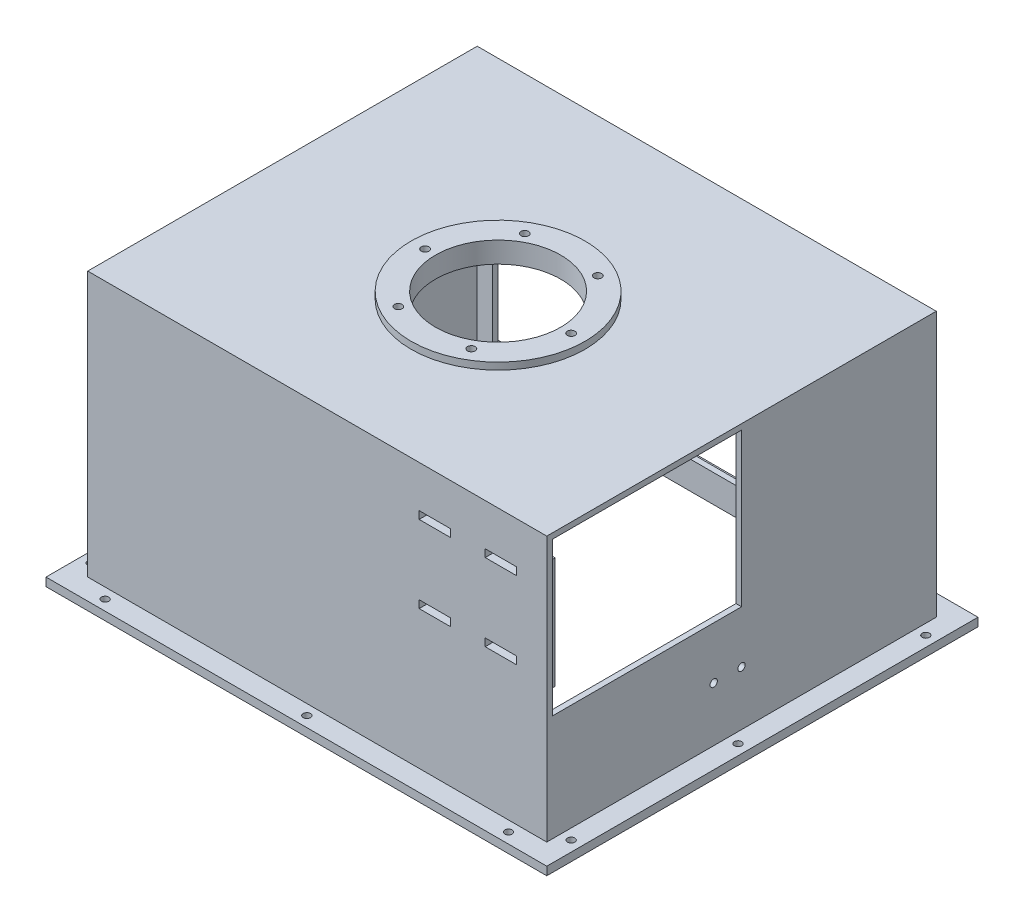
from build123d import *

# Parameters (mm, degrees)
SCHIZZO1_W                        = 720
SCHIZZO1_H                        = 620
ESTRUSIONE_ESTRUSIONE1_DEPTH      = 393
SCHIZZO3_W                        = 720
SCHIZZO3_H                        = 620
SCHIZZO3_W_2                      = 660
SCHIZZO3_H_2                      = 560
TAGLIO_ESTRUSIONE1_DEPTH          = 381
SCHIZZO4_R                        = 5.25
TAGLIO_ESTRUSIONE2_DEPTH          = 12
SCHIZZO5_W                        = 644
SCHIZZO5_H                        = 544
TAGLIO_ESTRUSIONE3_DEPTH          = 385
ESTRUSIONE_ESTRUSIONE2_DEPTH      = 10
ESTRUSIONE_ESTRUSIONE2_DEPTH_BACK = 20
SCHIZZO6_R                        = 125
SCHIZZO7_R                        = 90
TAGLIO_ESTRUSIONE4_DEPTH          = 30
FORO_PER_VITE_M10_1_D             = 11
RIPETIZIONECIRCOLARE1_COUNT       = 6
SCHIZZO14_W                       = 600
SCHIZZO14_H                       = 300
TAGLIO_ESTRUSIONE5_DEPTH          = 8
SCHIZZO16_R                       = 5.25
TAGLIO_ESTRUSIONE6_DEPTH          = 8
TAGLIO_ESTRUSIONE7_START          = -8
SCHIZZO17_R                       = 5.25
TAGLIO_ESTRUSIONE7_DEPTH          = 8
SCHIZZO18_W                       = 272
SCHIZZO18_H                       = 220
TAGLIO_ESTRUSIONE8_DEPTH          = 8
SCHIZZO19_W                       = 200
SCHIZZO19_H                       = 160
ESTRUSIONE_ESTRUSIONE3_DEPTH      = 12
SCHIZZO20_W                       = 45
SCHIZZO20_H                       = 11
TAGLIO_ESTRUSIONE9_DEPTH          = 20


with BuildPart() as part:
    # Schizzo1 → Estrusione-Estrusione1 (new body)
    with BuildSketch(Plane(origin=(0, 0, 0), x_dir=(1, 0, 0), z_dir=(0, 1, 0))):
        with Locations((360, 310)):
            Rectangle(SCHIZZO1_W, SCHIZZO1_H)
    extrude(amount=ESTRUSIONE_ESTRUSIONE1_DEPTH)

    # Schizzo3 → Taglio-Estrusione1 (cut)
    with BuildSketch(Plane(origin=(0, 393, 0), x_dir=(1, 0, 0), z_dir=(0, 1, 0))):
        with Locations((360, 310)):
            Rectangle(SCHIZZO3_W, SCHIZZO3_H)
        with Locations((360, 310)):
            Rectangle(SCHIZZO3_W_2, SCHIZZO3_H_2, mode=Mode.SUBTRACT)
    extrude(amount=-TAGLIO_ESTRUSIONE1_DEPTH, mode=Mode.SUBTRACT)

    # Schizzo4 → Taglio-Estrusione2 (cut)
    with BuildSketch(Plane(origin=(0, 12, 0), x_dir=(1, 0, 0), z_dir=(0, 1, 0))):
        with Locations(Location((360, 605, 0), (0, 0, 270))):
            Circle(SCHIZZO4_R)
        with Locations(Location((650, 605, 0), (0, 0, 270))):
            Circle(SCHIZZO4_R)
        with Locations(Location((70, 605, 0), (0, 0, 90))):
            Circle(SCHIZZO4_R)
        with Locations(Location((650, 15, 0), (0, 0, 90))):
            Circle(SCHIZZO4_R)
        with Locations(Location((360, 15, 0), (0, 0, 90))):
            Circle(SCHIZZO4_R)
        with Locations(Location((70, 15, 0), (0, 0, 270))):
            Circle(SCHIZZO4_R)
        with Locations(Location((705, 560, 0), (0, 0, 270))):
            Circle(SCHIZZO4_R)
        with Locations(Location((705, 290, 0), (0, 0, 270))):
            Circle(SCHIZZO4_R)
        with Locations(Location((705, 50, 0), (0, 0, 270))):
            Circle(SCHIZZO4_R)
        with Locations(Location((15, 50, 0), (0, 0, 90))):
            Circle(SCHIZZO4_R)
        with Locations(Location((15, 290, 0), (0, 0, 90))):
            Circle(SCHIZZO4_R)
        with Locations(Location((15, 560, 0), (0, 0, 90))):
            Circle(SCHIZZO4_R)
    extrude(amount=-TAGLIO_ESTRUSIONE2_DEPTH, mode=Mode.SUBTRACT)

    # Schizzo5 → Taglio-Estrusione3 (cut)
    with BuildSketch(Plane(origin=(0, 0, 0), x_dir=(1, 0, 0), z_dir=(0, 1, 0))):
        with Locations((360, 310)):
            Rectangle(SCHIZZO5_W, SCHIZZO5_H)
    extrude(amount=TAGLIO_ESTRUSIONE3_DEPTH, mode=Mode.SUBTRACT)

    # Schizzo6 → Estrusione-Estrusione2 (add, two sides: drawn at the far end of the back side and taken through both)
    with BuildSketch(Plane(origin=(0, 393, 0), x_dir=(1, 0, 0), z_dir=(0, 1, 0)).offset(-ESTRUSIONE_ESTRUSIONE2_DEPTH_BACK)):
        with Locations(Location((360, 290, 0), (0, 0, 270))):
            Circle(SCHIZZO6_R)
    extrude(amount=ESTRUSIONE_ESTRUSIONE2_DEPTH + ESTRUSIONE_ESTRUSIONE2_DEPTH_BACK)

    # Schizzo7 → Taglio-Estrusione4 (cut)
    with BuildSketch(Plane(origin=(0, 403, 0), x_dir=(1, 0, 0), z_dir=(0, 1, 0))):
        with Locations(Location((360, 290, 0), (0, 0, 270))):
            Circle(SCHIZZO7_R)
    extrude(amount=-TAGLIO_ESTRUSIONE4_DEPTH, mode=Mode.SUBTRACT)

    # Foro per Vite M10-1 (through all)
    with Locations(Plane(origin=(465, 403, -290), x_dir=(0, 0, 1), z_dir=(0, 1, 0))):
        with Locations((0, 0)):
            foro_per_vite_m10_1 = Hole(FORO_PER_VITE_M10_1_D / 2)

    # RipetizioneCircolare1: Foro per Vite M10-1 ×6 about axis
    ripetizionecircolare1_axis = Axis((360, 0, -290), (0, 1, 0))
    for i in range(1, RIPETIZIONECIRCOLARE1_COUNT):
        add(foro_per_vite_m10_1.rotate(ripetizionecircolare1_axis, i * 360 / RIPETIZIONECIRCOLARE1_COUNT), mode=Mode.SUBTRACT)

    # Schizzo14 → Taglio-Estrusione5 (cut)
    with BuildSketch(Plane.XY.offset(-582)):
        with Locations((360, 190)):
            Rectangle(SCHIZZO14_W, SCHIZZO14_H)
    extrude(amount=-TAGLIO_ESTRUSIONE5_DEPTH, mode=Mode.SUBTRACT)

    # Schizzo16 → Taglio-Estrusione6 (cut)
    with BuildSketch(Plane.ZY.offset(-30)):
        with Locations((-310, 90)):
            Circle(SCHIZZO16_R)
        with Locations((-270, 90)):
            Circle(SCHIZZO16_R)
    extrude(amount=-TAGLIO_ESTRUSIONE6_DEPTH, mode=Mode.SUBTRACT)

    # Schizzo17 → Taglio-Estrusione7 (cut)
    with BuildSketch(Plane(origin=(690, 0, 0), x_dir=(0, 0, -1), z_dir=(1, 0, 0)).offset(TAGLIO_ESTRUSIONE7_START)):
        with Locations(Location((310, 90, 0), (0, 0, 180))):
            Circle(SCHIZZO17_R)
        with Locations(Location((270, 90, 0), (0, 0, 180))):
            Circle(SCHIZZO17_R)
    extrude(amount=TAGLIO_ESTRUSIONE7_DEPTH, mode=Mode.SUBTRACT)

    # Schizzo18 → Taglio-Estrusione8 (cut)
    with BuildSketch(Plane.ZY.offset(-682)):
        with Locations((-174, 275)):
            Rectangle(SCHIZZO18_W, SCHIZZO18_H)
    extrude(amount=-TAGLIO_ESTRUSIONE8_DEPTH, mode=Mode.SUBTRACT)

    # Schizzo19 → Estrusione-Estrusione3 (add)
    with BuildSketch(Plane(origin=(0, 0, -38), x_dir=(-1, 0, 0), z_dir=(0, 0, -1))):
        with Locations((-582, 272)):
            Rectangle(SCHIZZO19_W, SCHIZZO19_H)
    extrude(amount=ESTRUSIONE_ESTRUSIONE3_DEPTH)

    # Schizzo20 → Taglio-Estrusione9 (cut)
    with BuildSketch(Plane(origin=(0, 0, -50), x_dir=(-1, 0, 0), z_dir=(0, 0, -1))):
        with Locations((-624, 216.5)):
            Rectangle(SCHIZZO20_W, SCHIZZO20_H)
        with Locations((-529, 216.5)):
            Rectangle(SCHIZZO20_W, SCHIZZO20_H)
        with Locations((-529, 327.5)):
            Rectangle(SCHIZZO20_W, SCHIZZO20_H)
        with Locations((-624, 327.5)):
            Rectangle(SCHIZZO20_W, SCHIZZO20_H)
    extrude(amount=-TAGLIO_ESTRUSIONE9_DEPTH, mode=Mode.SUBTRACT)


solid = part.part
